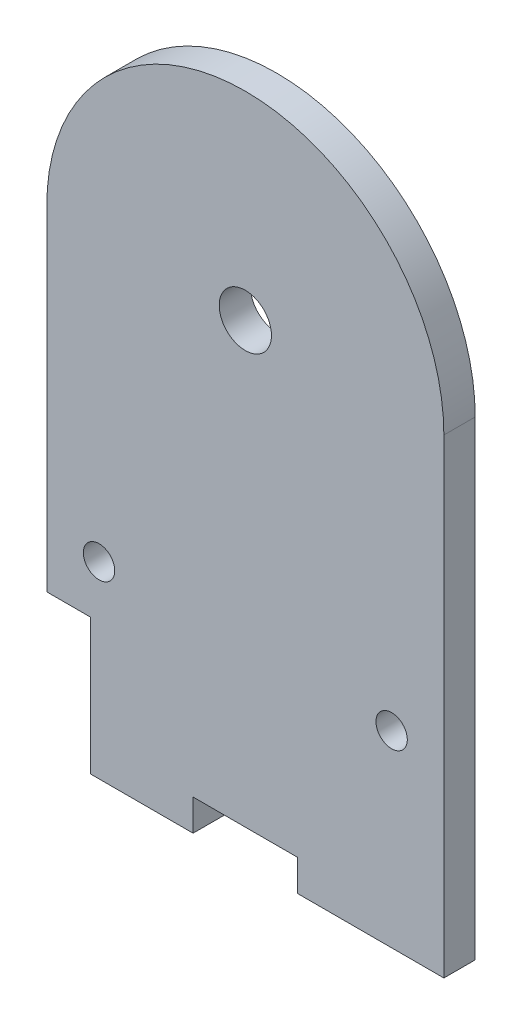
from build123d import *

# Parameters (mm, degrees)
SKETCH1_R           = 2.5
SKETCH1_R_2         = 1.5
BOSS_EXTRUDE1_DEPTH = 3


with BuildPart() as part:
    # Sketch1 → Boss-Extrude1 (new body)
    with BuildSketch(Plane.XY):
        with BuildLine():
            Line((-19, 0), (-19, -32))
            Line((-19, -32), (-14.8, -32))
            Line((-14.8, -32), (-14.8, -45))
            Line((-14.8, -45), (-5, -45))
            Line((-5, -45), (-5, -42))
            Line((-5, -42), (5, -42))
            Line((5, -42), (5, -45))
            Line((5, -45), (19, -45))
            Line((19, -45), (19, 0))
            ThreePointArc((19, 0), (0, 19), (-19, 0))
        make_face()
        Circle(SKETCH1_R, mode=Mode.SUBTRACT)
        with Locations((-14, -27)):
            Circle(SKETCH1_R_2, mode=Mode.SUBTRACT)
        with Locations(Location((14, -27, 0), (0, 0, 180))):
            Circle(SKETCH1_R_2, mode=Mode.SUBTRACT)
    extrude(amount=BOSS_EXTRUDE1_DEPTH)


solid = part.part
